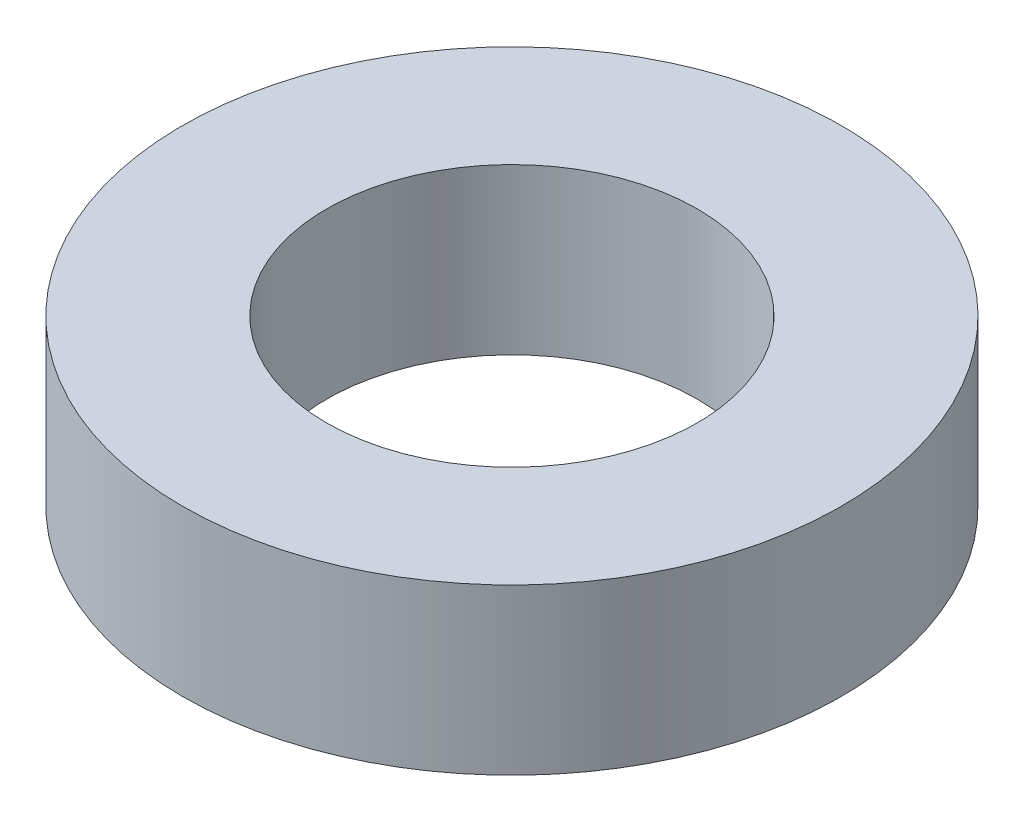
from build123d import *

# Parameters (mm, degrees)
SKETCH_1_R      = 8
SKETCH_1_R_2    = 4.5
EXTRUDE_1_DEPTH = 4


with BuildPart() as part:
    # 草图1 → 凸台-拉伸1 (new body)
    with BuildSketch(Plane(origin=(0, 0, 0), x_dir=(1, 0, 0), z_dir=(0, 1, 0))):
        with Locations(Location((0, 0, 0), (0, 0, 270))):
            Circle(SKETCH_1_R)
        with Locations(Location((0, 0, 0), (0, 0, 270))):
            Circle(SKETCH_1_R_2, mode=Mode.SUBTRACT)
    extrude(amount=EXTRUDE_1_DEPTH)


solid = part.part
